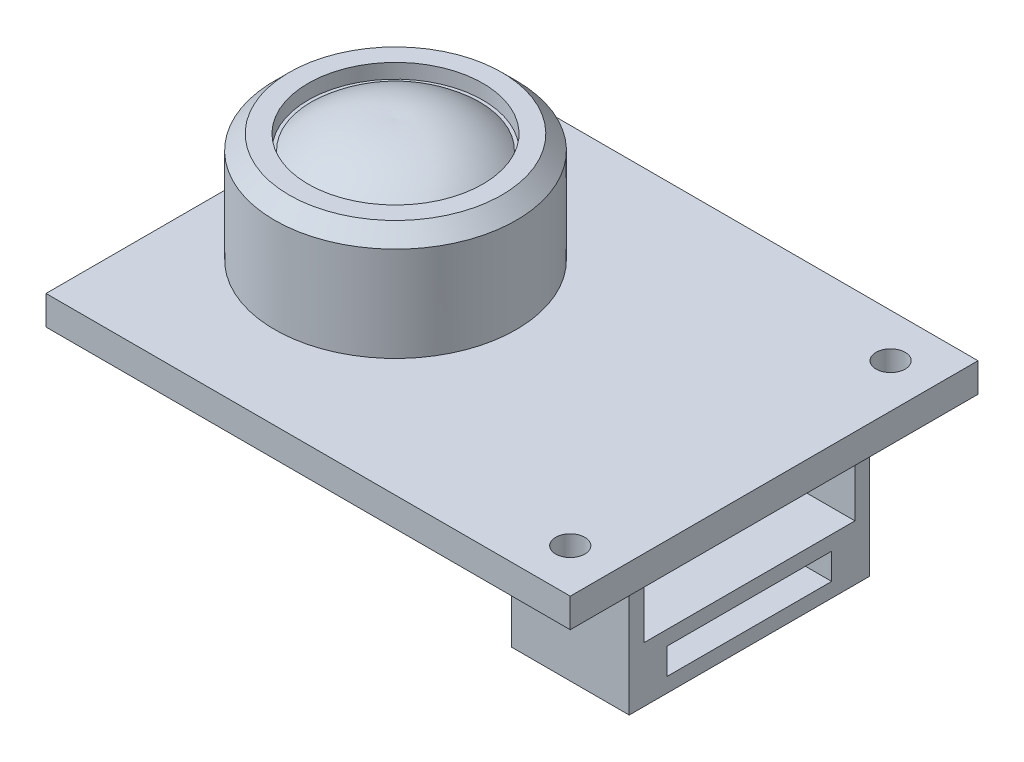
from build123d import *

# Parameters (mm, degrees)
SKETCH1_W           = 18
SKETCH1_H           = 14
SKETCH1_R           = 0.5
BOSS_EXTRUDE1_DEPTH = 1
SKETCH2_R           = 4.15
BOSS_EXTRUDE2_DEPTH = 3.75
SKETCH3_W           = 4.05
SKETCH3_H           = 8.25
BOSS_EXTRUDE3_DEPTH = 4.4
SKETCH4_W           = 7.25
SKETCH4_H           = 2
SKETCH4_W_2         = 5.65
SKETCH4_H_2         = 0.9
CUT_EXTRUDE1_DEPTH  = 3
SKETCH5_R           = 3
CUT_EXTRUDE2_DEPTH  = 0.5
CHAMFER1_SIZE       = 0.5


with BuildPart() as part:
    # Sketch1 → Boss-Extrude1 (new body)
    with BuildSketch(Plane(origin=(0, 0, 0), x_dir=(1, 0, 0), z_dir=(0, 1, 0))):
        with Locations((9, 7)):
            Rectangle(SKETCH1_W, SKETCH1_H)
        with Locations(Location((16.5, 12.5, 0), (0, 0, 270))):
            Circle(SKETCH1_R, mode=Mode.SUBTRACT)
        with Locations(Location((16.5, 1.5, 0), (0, 0, 270))):
            Circle(SKETCH1_R, mode=Mode.SUBTRACT)
    extrude(amount=BOSS_EXTRUDE1_DEPTH)

    # Sketch2 → Boss-Extrude2 (add)
    with BuildSketch(Plane(origin=(0, 1, 0), x_dir=(1, 0, 0), z_dir=(0, 1, 0))):
        with Locations(Location((5, 7, 0), (0, 0, 90))):
            Circle(SKETCH2_R)
    extrude(amount=BOSS_EXTRUDE2_DEPTH)

    # Sketch3 → Boss-Extrude3 (add)
    with BuildSketch(Plane(origin=(0, 0, 0), x_dir=(-1, 0, 0), z_dir=(0, -1, 0))):
        with Locations((-15.125, 7)):
            Rectangle(SKETCH3_W, SKETCH3_H)
    extrude(amount=BOSS_EXTRUDE3_DEPTH)

    # Sketch4 → Cut-Extrude1 (cut)
    with BuildSketch(Plane(origin=(17.15, 0, 0), x_dir=(0, 0, -1), z_dir=(1, 0, 0))):
        with Locations((7, -1.5)):
            Rectangle(SKETCH4_W, SKETCH4_H)
        with Locations((7, -3.45)):
            Rectangle(SKETCH4_W_2, SKETCH4_H_2)
    extrude(amount=-CUT_EXTRUDE1_DEPTH, mode=Mode.SUBTRACT)

    # Sketch5 → Cut-Extrude2 (cut)
    with BuildSketch(Plane(origin=(0, 4.75, 0), x_dir=(1, 0, 0), z_dir=(0, 1, 0))):
        with Locations(Location((5, 7, 0), (0, 0, 270))):
            Circle(SKETCH5_R)
    extrude(amount=-CUT_EXTRUDE2_DEPTH, mode=Mode.SUBTRACT)

    # Chamfer1
    chamfer1_edges = [part.edges().sort_by_distance(p)[0] for p in [
        (5, 4.75, -2.85),
    ]]
    chamfer(chamfer1_edges, length=CHAMFER1_SIZE)

    # Sketch7 → Revolve2 (revolve)
    with BuildSketch(Plane.XY.offset(-7)):
        with BuildLine():
            add(Edge.make_bspline(
                [(2.090335023, 4.232825991), (3.350844408, 5.324759463), (4.998474219, 5.209553412)],
                knots=[0, 0, 0, 1, 1, 1], degree=2))
            Line((4.998474219, 5.209553412), (4.998474219, 4.232825991))
            Line((4.998474219, 4.232825991), (2.090335023, 4.232825991))
        make_face()
    revolve(axis=Axis((4.998474219, 4.232825991, -7), (0, 1, 0)))


solid = part.part
